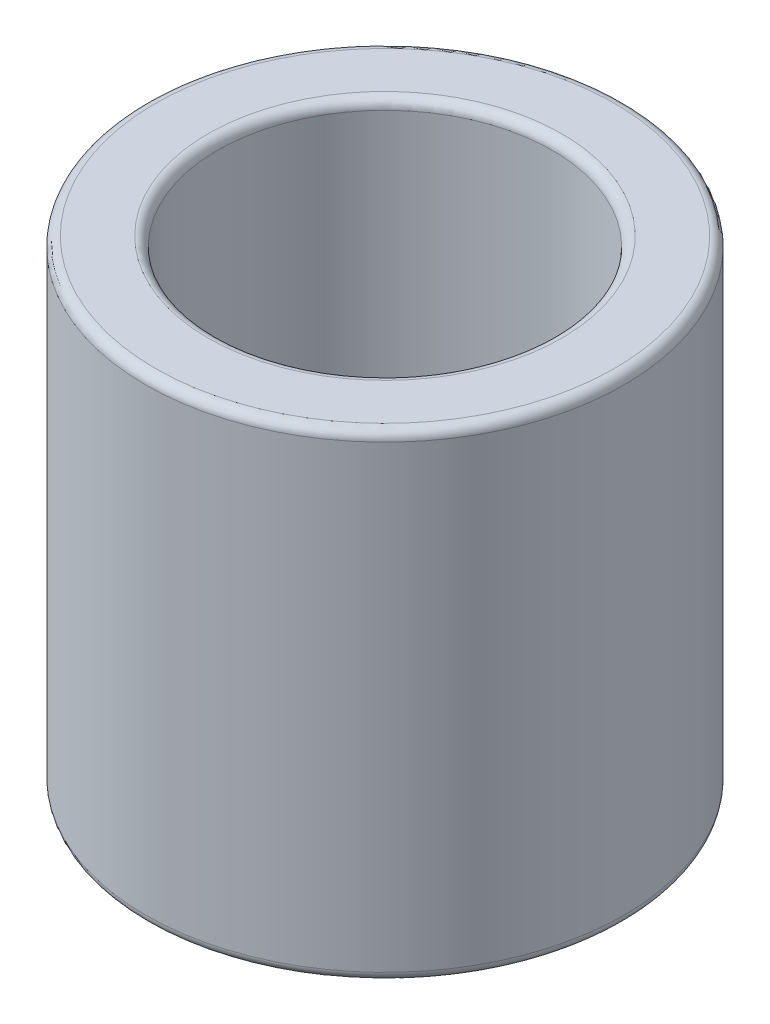
from build123d import *

# Parameters (mm, degrees)
SKETCH1_R           = 2.5
SKETCH1_R_2         = 1.75
BOSS_EXTRUDE1_DEPTH = 5
FILLET1_R           = 0.1


with BuildPart() as part:
    # Sketch1 → Boss-Extrude1 (new body)
    with BuildSketch(Plane(origin=(0, 0, 0), x_dir=(1, 0, 0), z_dir=(0, 1, 0))):
        with Locations(Location((0, 0, 0), (0, 0, 270))):
            Circle(SKETCH1_R)
        with Locations(Location((0, 0, 0), (0, 0, 270))):
            Circle(SKETCH1_R_2, mode=Mode.SUBTRACT)
    extrude(amount=BOSS_EXTRUDE1_DEPTH)

    # Fillet1
    fillet1_edges = [part.edges().sort_by_distance(p)[0] for p in [
        (0, 0, -2.5),
        (0, 5, -2.5),
        (0, 0, -1.75),
        (0, 5, -1.75),
    ]]
    fillet(fillet1_edges, radius=FILLET1_R)


solid = part.part
